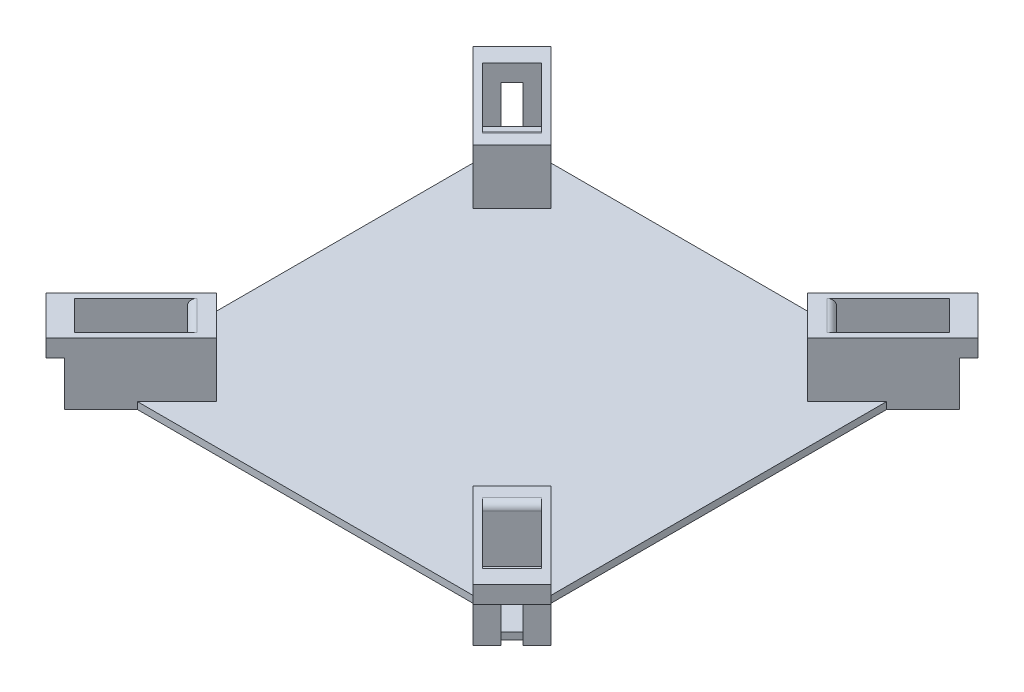
from build123d import *

# Parameters (mm, degrees)
SKETCH1_W            = 120
SKETCH1_H            = 120
BOSS_EXTRUDE1_DEPTH  = 2
BOSS_EXTRUDE2_DEPTH  = 13
MIRROR2_COPY_1_DEPTH = 13
CUT_EXTRUDE1_DEPTH   = 16.5
MIRROR4_COPY_1_DEPTH = 16.5
BOSS_EXTRUDE3_DEPTH  = 5
CUT_EXTRUDE2_DEPTH   = 6
MIRROR6_COPY_1_DEPTH = 5
MIRROR6_COPY_2_DEPTH = 6
FILLET1_R            = 2
FILLET2_R            = 2
FILLET3_R            = 2
FILLET4_R            = 2


with BuildPart() as part:
    # Sketch1 → Boss-Extrude1 (new body)
    with BuildSketch(Plane(origin=(0, 0, 0), x_dir=(1, 0, 0), z_dir=(0, 1, 0))):
        Polygon((-59.292893219, -70.606601718), (-48.686291501, -60), (-60, -60), (-60, -48.686291501), (-70.606601718, -59.292893219), align=None)
        Polygon((-70.606601718, 59.292893219), (-60, 48.686291501), (-60, 60), (-48.686291501, 60), (-59.292893219, 70.606601718), align=None)
        Rectangle(SKETCH1_W, SKETCH1_H)
        Polygon((60, 60), (60, 48.686291501), (70.606601718, 59.292893219), (59.292893219, 70.606601718), (48.686291501, 60), align=None)
        Polygon((60, -48.686291501), (60, -60), (48.686291501, -60), (59.292893219, -70.606601718), (70.606601718, -59.292893219), align=None)
    extrude(amount=BOSS_EXTRUDE1_DEPTH)

    # Sketch2 → Boss-Extrude2 (add)
    with BuildSketch(Plane(origin=(0, 0, 0), x_dir=(1, 0, 0), z_dir=(0, 1, 0))):
        Polygon((59.292893219, -70.606601718), (70.606601718, -59.292893219), (69.192388155, -57.878679656), (52.787510832, -41.473802333), (48.544870145, -37.231161646), (37.231161646, -48.544870145), (41.473802333, -52.787510832), (57.878679656, -69.192388155), align=None)
        Polygon((59.222182541, -67.848885271), (67.848885271, -59.222182541), (51.444007948, -42.817305217), (42.817305217, -51.444007948), align=None, mode=Mode.SUBTRACT)
    boss_extrude2 = extrude(amount=BOSS_EXTRUDE2_DEPTH)

    # Mirror1: Boss-Extrude2 across plane
    add(boss_extrude2.mirror(Plane(origin=(0, 0, 0), x_dir=(0, 0, 1), z_dir=(1, 0, 0))))

    # Mirror2: Boss-Extrude2 across plane
    add(boss_extrude2.mirror(Plane.XY))

    # Mirror2 copy 1 sketch → Mirror2 copy 1 (add)
    with BuildSketch(Plane(origin=(0, 0, 0), x_dir=(-1, 0, 0), z_dir=(0, 1, 0))):
        Polygon((59.292893219, -70.606601718), (70.606601718, -59.292893219), (69.192388155, -57.878679656), (52.787510832, -41.473802333), (48.544870145, -37.231161646), (37.231161646, -48.544870145), (41.473802333, -52.787510832), (57.878679656, -69.192388155), align=None)
        Polygon((59.222182541, -67.848885271), (67.848885271, -59.222182541), (51.444007948, -42.817305217), (42.817305217, -51.444007948), align=None, mode=Mode.SUBTRACT)
    extrude(amount=MIRROR2_COPY_1_DEPTH)

    # Sketch3 → Cut-Extrude1 (cut)
    with BuildSketch(Plane(origin=(0, 13, 0), x_dir=(1, 0, 0), z_dir=(0, 1, 0))):
        Polygon((61.944543648, -65.126524164), (63.358757211, -66.540737726), (66.540737726, -63.358757211), (65.126524164, -61.944543648), align=None)
    cut_extrude1 = extrude(amount=-CUT_EXTRUDE1_DEPTH, mode=Mode.SUBTRACT)

    # Mirror3: Cut-Extrude1 across plane
    add(cut_extrude1.mirror(Plane(origin=(0, 0, 0), x_dir=(0, 0, 1), z_dir=(1, 0, 0))), mode=Mode.SUBTRACT)

    # Mirror4: Cut-Extrude1 across plane
    add(cut_extrude1.mirror(Plane.XY), mode=Mode.SUBTRACT)

    # Mirror4 copy 1 sketch → Mirror4 copy 1 (cut)
    with BuildSketch(Plane(origin=(0, 13, 0), x_dir=(-1, 0, 0), z_dir=(0, 1, 0))):
        Polygon((61.944543648, -65.126524164), (63.358757211, -66.540737726), (66.540737726, -63.358757211), (65.126524164, -61.944543648), align=None)
    extrude(amount=-MIRROR4_COPY_1_DEPTH, mode=Mode.SUBTRACT)

    # Sketch4 → Boss-Extrude3 (add)
    with BuildSketch(Plane(origin=(0, 13, 0), x_dir=(1, 0, 0), z_dir=(0, 1, 0))):
        Polygon((37.231161646, 48.544870145), (48.544870145, 37.231161646), (73.293607486, 61.979898987), (61.979898987, 73.293607486), align=None)
    boss_extrude3 = extrude(amount=BOSS_EXTRUDE3_DEPTH)

    # Sketch7 → Cut-Extrude2 (cut)
    with BuildSketch(Plane(origin=(0, 18, 0), x_dir=(1, 0, 0), z_dir=(0, 1, 0))):
        Polygon((42.817305217, 51.444007948), (51.444007948, 42.817305217), (67.848885271, 59.222182541), (59.222182541, 67.848885271), align=None)
    cut_extrude2 = extrude(amount=-CUT_EXTRUDE2_DEPTH, mode=Mode.SUBTRACT)

    # Mirror5: Boss-Extrude3, Cut-Extrude2 across plane
    add(boss_extrude3.mirror(Plane.XY))
    add(cut_extrude2.mirror(Plane.XY), mode=Mode.SUBTRACT)

    # Mirror6: Boss-Extrude3, Cut-Extrude2 across plane
    add(boss_extrude3.mirror(Plane(origin=(0, 0, 0), x_dir=(0, 0, 1), z_dir=(1, 0, 0))))
    add(cut_extrude2.mirror(Plane(origin=(0, 0, 0), x_dir=(0, 0, 1), z_dir=(1, 0, 0))), mode=Mode.SUBTRACT)

    # Mirror6 copy 1 sketch → Mirror6 copy 1 (add)
    with BuildSketch(Plane(origin=(0, 13, 0), x_dir=(-1, 0, 0), z_dir=(0, 1, 0))):
        Polygon((37.231161646, 48.544870145), (48.544870145, 37.231161646), (73.293607486, 61.979898987), (61.979898987, 73.293607486), align=None)
    extrude(amount=MIRROR6_COPY_1_DEPTH)

    # Mirror6 copy 2 sketch → Mirror6 copy 2 (cut)
    with BuildSketch(Plane(origin=(0, 18, 0), x_dir=(-1, 0, 0), z_dir=(0, 1, 0))):
        Polygon((42.817305217, 51.444007948), (51.444007948, 42.817305217), (67.848885271, 59.222182541), (59.222182541, 67.848885271), align=None)
    extrude(amount=-MIRROR6_COPY_2_DEPTH, mode=Mode.SUBTRACT)

    # Fillet1
    fillet1_edges = [part.edges().sort_by_distance(p)[0] for p in [
        (-47.130656582, 18, -47.130656582),
    ]]
    fillet(fillet1_edges, radius=FILLET1_R)

    # Fillet2
    fillet2_edges = [part.edges().sort_by_distance(p)[0] for p in [
        (-47.130656582, 18, 47.130656582),
    ]]
    fillet(fillet2_edges, radius=FILLET2_R)

    # Fillet3
    fillet3_edges = [part.edges().sort_by_distance(p)[0] for p in [
        (47.130656582, 18, -47.130656582),
    ]]
    fillet(fillet3_edges, radius=FILLET3_R)

    # Fillet4
    fillet4_edges = [part.edges().sort_by_distance(p)[0] for p in [
        (47.130656582, 18, 47.130656582),
    ]]
    fillet(fillet4_edges, radius=FILLET4_R)


solid = part.part
